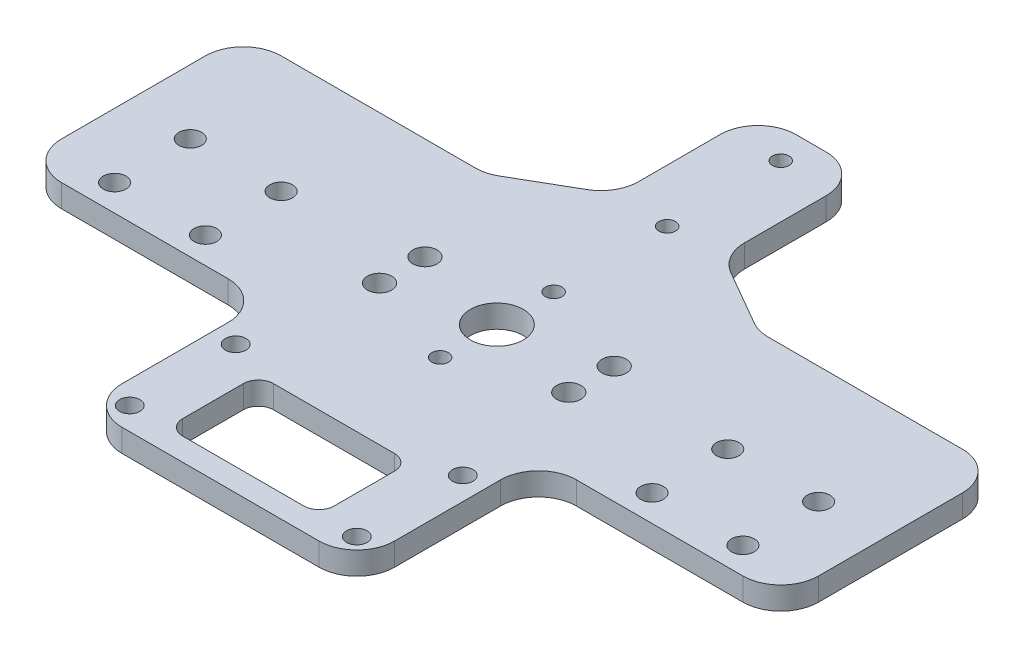
from build123d import *

# Parameters (mm, degrees)
SKETCH_1_R          = 1.35
SKETCH_1_R_2        = 1.1
SKETCH_1_R_3        = 3.5
SKETCH_1_W          = 20
SKETCH_1_H          = 12
EXTRUDE_1_DEPTH     = 3
FILLET_1_R          = 5
SKETCH_2_R          = 1.6
CUT_EXTRUDE_1_DEPTH = 104.522944317
FILLET_2_R          = 2
SKETCH_4_R          = 1.5
CUT_EXTRUDE_3_DEPTH = 104.522944317


with BuildPart() as part:
    # 草图1 → 凸台-拉伸1 (new body)
    with BuildSketch(Plane(origin=(0, 0, 0), x_dir=(1, 0, 0), z_dir=(0, 1, 0))):
        Polygon((0, 0), (36, 0), (36, 24), (68, 24), (68, 29), (68, 53), (36, 53), (25, 59.350852961), (25, 78), (11, 78), (11, 59.350852961), (0, 53), (-32, 53), (-32, 29), (-32, 24), (0, 24), align=None)
        with Locations(Location((3, 3, 0), (0, 0, 270))):
            Circle(SKETCH_1_R, mode=Mode.SUBTRACT)
        with Locations(Location((3, 17, 0), (0, 0, 90))):
            Circle(SKETCH_1_R, mode=Mode.SUBTRACT)
        with Locations(Location((33, 3, 0), (0, 0, 90))):
            Circle(SKETCH_1_R, mode=Mode.SUBTRACT)
        with Locations(Location((33, 17, 0), (0, 0, 270))):
            Circle(SKETCH_1_R, mode=Mode.SUBTRACT)
        with Locations(Location((18, 74, 0), (0, 0, 270))):
            Circle(SKETCH_1_R_2, mode=Mode.SUBTRACT)
        with Locations(Location((18, 59, 0), (0, 0, 270))):
            Circle(SKETCH_1_R_2, mode=Mode.SUBTRACT)
        with Locations(Location((18, 44, 0), (0, 0, 270))):
            Circle(SKETCH_1_R_2, mode=Mode.SUBTRACT)
        with Locations(Location((18, 29, 0), (0, 0, 270))):
            Circle(SKETCH_1_R_2, mode=Mode.SUBTRACT)
        with Locations(Location((18, 36.5, 0), (0, 0, 270))):
            Circle(SKETCH_1_R_3, mode=Mode.SUBTRACT)
        with Locations((18, 9)):
            Rectangle(SKETCH_1_W, SKETCH_1_H, mode=Mode.SUBTRACT)
    extrude(amount=EXTRUDE_1_DEPTH)

    # 圆角1
    fillet_1_edges = [part.edges().sort_by_distance(p)[0] for p in [
        (11, 1.5, -78),
        (25, 1.5, -78),
        (25, 1.5, -59.350852961),
        (36, 1.5, -53),
        (68, 1.5, -53),
        (68, 1.5, -24),
        (36, 1.5, -24),
        (36, 1.5, 0),
        (0, 1.5, 0),
        (0, 1.5, -24),
        (-32, 1.5, -24),
        (-32, 1.5, -53),
        (0, 1.5, -53),
        (11, 1.5, -59.350852961),
    ]]
    fillet(fillet_1_edges, radius=FILLET_1_R)

    # 草图2 → 切除-拉伸1 (cut, through all)
    with BuildSketch(Plane(origin=(0, 3, 0), x_dir=(1, 0, 0), z_dir=(0, 1, 0))):
        with Locations(Location((5.5, 39.5, 0), (0, 0, 270))):
            Circle(SKETCH_2_R)
        with Locations(Location((5.5, 33.5, 0), (0, 0, 90))):
            Circle(SKETCH_2_R)
        with Locations(Location((30.5, 33.5, 0), (0, 0, 270))):
            Circle(SKETCH_2_R)
        with Locations(Location((30.5, 39.5, 0), (0, 0, 90))):
            Circle(SKETCH_2_R)
    extrude(amount=-CUT_EXTRUDE_1_DEPTH, mode=Mode.SUBTRACT)

    # 圆角2
    fillet_2_edges = [part.edges().sort_by_distance(p)[0] for p in [
        (28, 1.5, -3),
        (28, 1.5, -15),
        (8, 1.5, -15),
        (8, 1.5, -3),
    ]]
    fillet(fillet_2_edges, radius=FILLET_2_R)

    # 草图4 → 切除-拉伸3 (cut, through all)
    with BuildSketch(Plane(origin=(0, 3, 0), x_dir=(1, 0, 0), z_dir=(0, 1, 0))):
        with Locations(Location((-23.5, 37.5, 0), (0, 0, 270))):
            Circle(SKETCH_4_R)
        with Locations(Location((-23.5, 27.5, 0), (0, 0, 270))):
            Circle(SKETCH_4_R)
        with Locations(Location((-11.5, 37.5, 0), (0, 0, 270))):
            Circle(SKETCH_4_R)
        with Locations(Location((-11.5, 27.5, 0), (0, 0, 270))):
            Circle(SKETCH_4_R)
        with Locations(Location((47.5, 27.5, 0), (0, 0, 270))):
            Circle(SKETCH_4_R)
        with Locations(Location((47.5, 37.5, 0), (0, 0, 270))):
            Circle(SKETCH_4_R)
        with Locations(Location((59.5, 37.5, 0), (0, 0, 270))):
            Circle(SKETCH_4_R)
        with Locations(Location((59.5, 27.5, 0), (0, 0, 270))):
            Circle(SKETCH_4_R)
    extrude(amount=-CUT_EXTRUDE_3_DEPTH, mode=Mode.SUBTRACT)


solid = part.part
